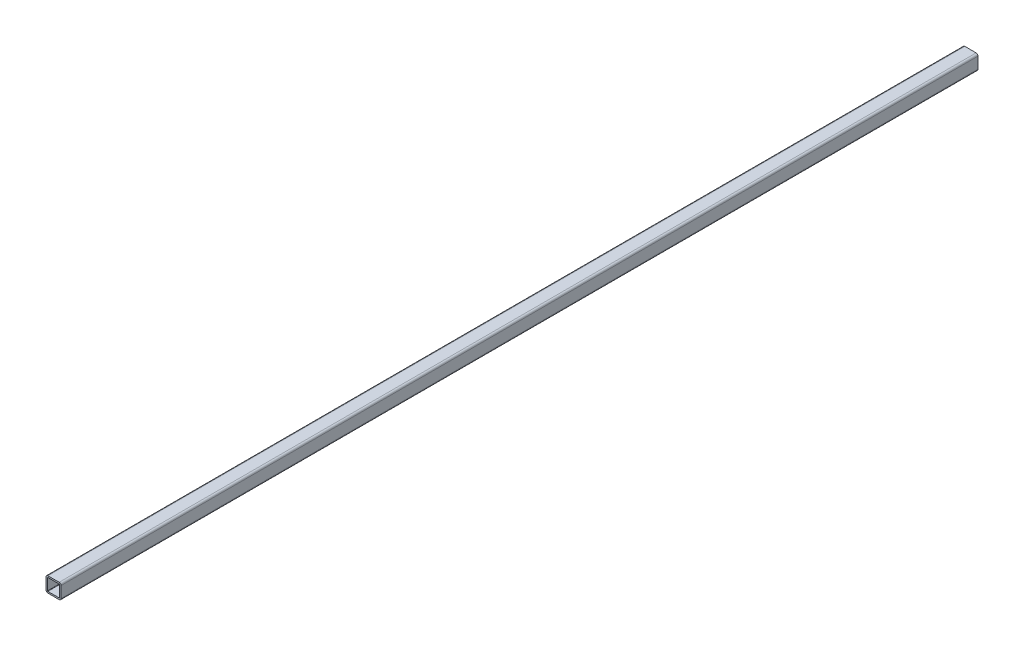
from build123d import *

# Parameters (mm, degrees)
EXTRUDE_THIN1_DEPTH = 609.6


with BuildPart() as part:
    # Sketch1 → Extrude-Thin1 (new, symmetric)
    with BuildSketch(Plane.XY):
        with BuildLine():
            Line((-10, -7.5), (-10, 7.5))
            ThreePointArc((-10, 7.5), (-9.267766953, 9.267766953), (-7.5, 10))
            Line((-7.5, 10), (7.5, 10))
            ThreePointArc((7.5, 10), (9.267766953, 9.267766953), (10, 7.5))
            Line((10, 7.5), (10, -7.5))
            ThreePointArc((10, -7.5), (9.267766953, -9.267766953), (7.5, -10))
            Line((7.5, -10), (-7.5, -10))
            ThreePointArc((-7.5, -10), (-9.267766953, -9.267766953), (-10, -7.5))
        make_face()
        with BuildLine():
            Line((-8, -7.5), (-8, 7.5))
            ThreePointArc((-8, 7.5), (-7.853553391, 7.853553391), (-7.5, 8))
            Line((-7.5, 8), (7.5, 8))
            ThreePointArc((7.5, 8), (7.853553391, 7.853553391), (8, 7.5))
            Line((8, 7.5), (8, -7.5))
            ThreePointArc((8, -7.5), (7.853553391, -7.853553391), (7.5, -8))
            Line((7.5, -8), (-7.5, -8))
            ThreePointArc((-7.5, -8), (-7.853553391, -7.853553391), (-8, -7.5))
        make_face(mode=Mode.SUBTRACT)
    extrude(amount=EXTRUDE_THIN1_DEPTH, both=True)


solid = part.part
